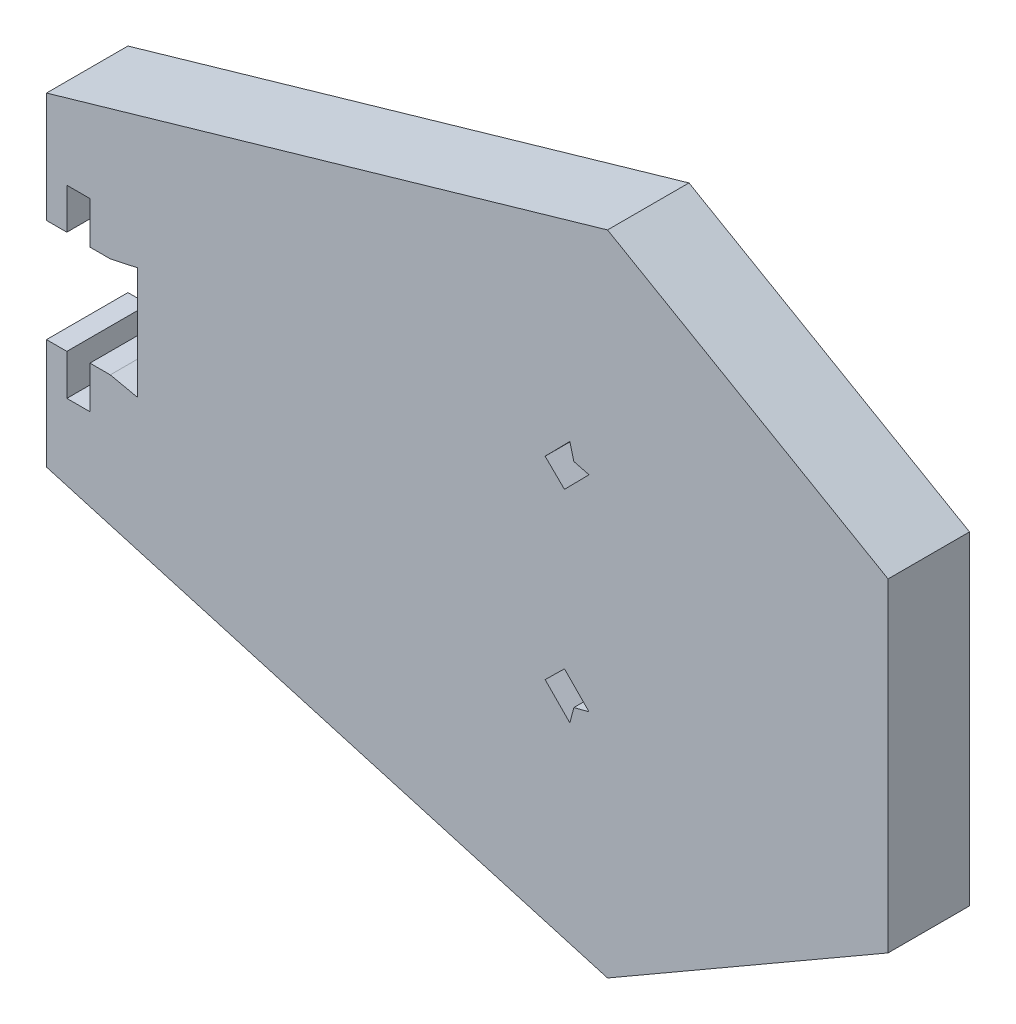
from build123d import *

# Parameters (mm, degrees)
BOSS_EXTRUDE1_DEPTH = 6
CUT_EXTRUDE1_DEPTH  = 44.729898027


with BuildPart() as part:
    # Sketch1 → Boss-Extrude1 (new body)
    # profile 1 of 2: a face of its own
    with BuildSketch(Plane.XY):
        Polygon((25.85, -11.931905563), (25.85, 0), (-29.45, 0), (-29.45, -4.132124935), (-31.45, -3.7), (-36.15, -3.7), (-36.15, -11.931905563), (5.183333333, -23.863811127), align=None)
        Polygon((2.700425446, -7.850425446), (2.408714576, -8.979109263), (0.584447895, -7.127556852), (2.009048725, -5.723949904), (3.819278422, -7.561255379), align=None, mode=Mode.SUBTRACT)
    # profile 2 of 2: a face of its own
    with BuildSketch(Plane.XY):
        Polygon((25.85, 0), (25.85, 11.931905563), (5.183333333, 23.863811127), (-36.15, 11.931905563), (-36.15, 3.7), (-31.45, 3.7), (-29.45, 4.132124935), (-29.45, 0), align=None)
        Polygon((2.408714576, 8.979109263), (2.700425446, 7.850425446), (3.819278422, 7.561255379), (2.009048725, 5.723949904), (0.584447895, 7.127556852), align=None, mode=Mode.SUBTRACT)
    extrude(amount=BOSS_EXTRUDE1_DEPTH)

    # Sketch2 → Cut-Extrude1 (cut, through all)
    with BuildSketch(Plane.XY.offset(6)):
        Polygon((-36.25, -3.427539205), (-36.25, -3.8), (-34.65, -3.8), (-34.65, -6.8), (-32.95, -6.8), (-32.95, 6.8), (-34.65, 6.8), (-34.65, 3.8), (-36.25, 3.8), (-36.25, 3.427539205), align=None)
    extrude(amount=-CUT_EXTRUDE1_DEPTH, mode=Mode.SUBTRACT)


solid = part.part
